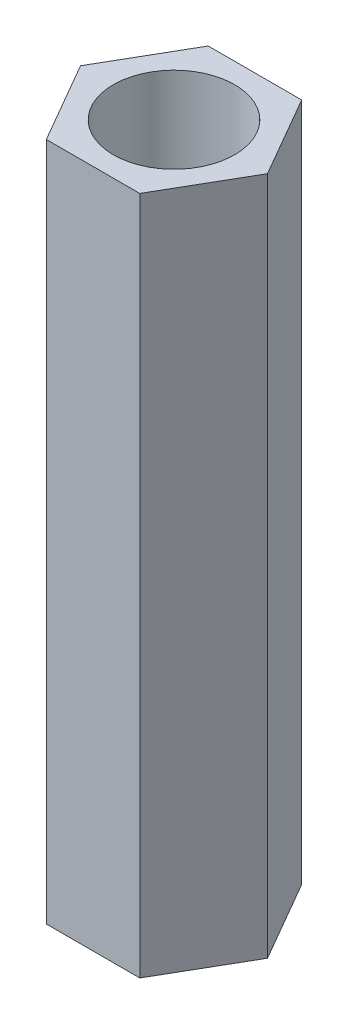
from build123d import *

# Parameters (mm, degrees)
SKETCH1_R           = 2.25
BOSS_EXTRUDE1_DEPTH = 25.18


with BuildPart() as part:
    # Sketch1 → Boss-Extrude1 (new body)
    with BuildSketch(Plane(origin=(0, 0, 0), x_dir=(1, 0, 0), z_dir=(0, 1, 0))):
        Polygon((1.732050808, -3), (3.464101615, 0), (1.732050808, 3), (-1.732050808, 3), (-3.464101615, 0), (-1.732050808, -3), align=None)
        with Locations(Location((0, 0, 0), (0, 0, 270))):
            Circle(SKETCH1_R, mode=Mode.SUBTRACT)
    extrude(amount=BOSS_EXTRUDE1_DEPTH)


solid = part.part
